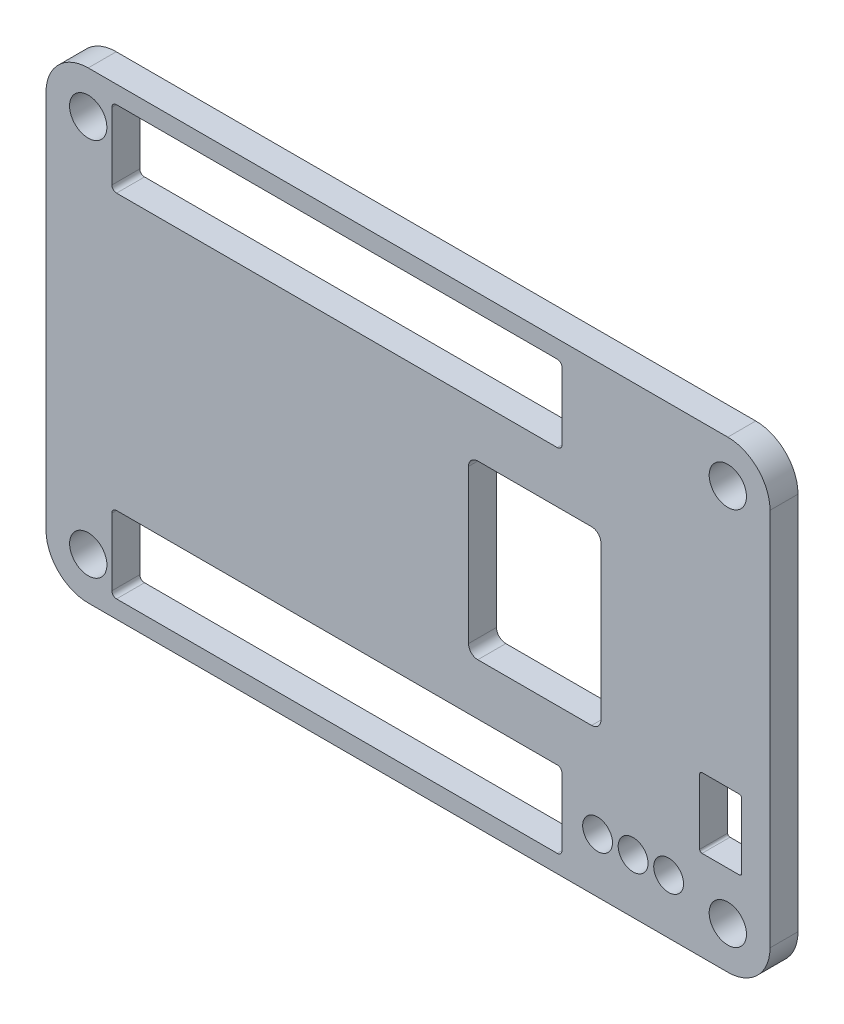
from build123d import *

# Parameters (mm, degrees)
SKETCH_1_R          = 2
EXTRUDE_1_DEPTH     = 1.5
SKETCH_2_R          = 1.6
CUT_EXTRUDE_1_DEPTH = 3


with BuildPart() as part:
    # 草图1 → 凸台-拉伸1 (new, symmetric)
    with BuildSketch(Plane.XY):
        with BuildLine():
            Line((-34.285, 24.845), (34.285, 24.845))
            ThreePointArc((34.285, 24.845), (37.488193719, 23.518193719), (38.815, 20.315))
            Line((38.815, 20.315), (38.815, -20.315))
            ThreePointArc((38.815, -20.315), (37.488193719, -23.518193719), (34.285, -24.845))
            Line((34.285, -24.845), (-34.285, -24.845))
            ThreePointArc((-34.285, -24.845), (-37.488193719, -23.518193719), (-38.815, -20.315))
            Line((-38.815, -20.315), (-38.815, 20.315))
            ThreePointArc((-38.815, 20.315), (-37.488193719, 23.518193719), (-34.285, 24.845))
        make_face()
        with Locations((34.29, 20.32)):
            Circle(SKETCH_1_R, mode=Mode.SUBTRACT)
        with Locations((34.29, -20.32)):
            Circle(SKETCH_1_R, mode=Mode.SUBTRACT)
        with Locations((-34.29, 20.32)):
            Circle(SKETCH_1_R, mode=Mode.SUBTRACT)
        with Locations((-34.285, -20.315)):
            Circle(SKETCH_1_R, mode=Mode.SUBTRACT)
    extrude(amount=EXTRUDE_1_DEPTH, both=True)

    # 草图2 → 切除-拉伸1 (cut)
    with BuildSketch(Plane.XY.offset(1.5)):
        with Locations((27.945, -19.005)):
            Circle(SKETCH_2_R)
        with Locations((24.135, -19.005)):
            Circle(SKETCH_2_R)
        with Locations((20.325, -19.005)):
            Circle(SKETCH_2_R)
        with BuildLine():
            Line((-31.255, 22.945), (16.005, 22.945))
            ThreePointArc((16.005, 22.945), (16.358553391, 22.798553391), (16.505, 22.445))
            Line((16.505, 22.445), (16.505, 15.235))
            ThreePointArc((16.505, 15.235), (16.358553391, 14.881446609), (16.005, 14.735))
            Line((16.005, 14.735), (-31.255, 14.735))
            ThreePointArc((-31.255, 14.735), (-31.608553391, 14.881446609), (-31.755, 15.235))
            Line((-31.755, 15.235), (-31.755, 22.445))
            ThreePointArc((-31.755, 22.445), (-31.608553391, 22.798553391), (-31.255, 22.945))
        make_face()
        with BuildLine():
            Line((-31.755, -22.445), (-31.755, -15.235))
            ThreePointArc((-31.755, -15.235), (-31.608553391, -14.881446609), (-31.255, -14.735))
            Line((-31.255, -14.735), (16.005, -14.735))
            ThreePointArc((16.005, -14.735), (16.358553391, -14.881446609), (16.505, -15.235))
            Line((16.505, -15.235), (16.505, -22.445))
            ThreePointArc((16.505, -22.445), (16.358553391, -22.798553391), (16.005, -22.945))
            Line((16.005, -22.945), (-31.255, -22.945))
            ThreePointArc((-31.255, -22.945), (-31.608553391, -22.798553391), (-31.755, -22.445))
        make_face()
        with BuildLine():
            Line((31.525, -7.685), (35.525, -7.685))
            ThreePointArc((35.525, -7.685), (35.701776695, -7.758223305), (35.775, -7.935))
            Line((35.775, -7.935), (35.775, -14.935))
            ThreePointArc((35.775, -14.935), (35.701776695, -15.111776695), (35.525, -15.185))
            Line((35.525, -15.185), (31.525, -15.185))
            ThreePointArc((31.525, -15.185), (31.348223305, -15.111776695), (31.275, -14.935))
            Line((31.275, -14.935), (31.275, -7.935))
            ThreePointArc((31.275, -7.935), (31.348223305, -7.758223305), (31.525, -7.685))
        make_face()
        with BuildLine():
            Line((7.485, 9.225), (19.685, 9.225))
            ThreePointArc((19.685, 9.225), (20.392106781, 8.932106781), (20.685, 8.225))
            Line((20.685, 8.225), (20.685, -8.225))
            ThreePointArc((20.685, -8.225), (20.392106781, -8.932106781), (19.685, -9.225))
            Line((19.685, -9.225), (7.485, -9.225))
            ThreePointArc((7.485, -9.225), (6.777893219, -8.932106781), (6.485, -8.225))
            Line((6.485, -8.225), (6.485, 8.225))
            ThreePointArc((6.485, 8.225), (6.777893219, 8.932106781), (7.485, 9.225))
        make_face()
    extrude(amount=-CUT_EXTRUDE_1_DEPTH, mode=Mode.SUBTRACT)


solid = part.part
